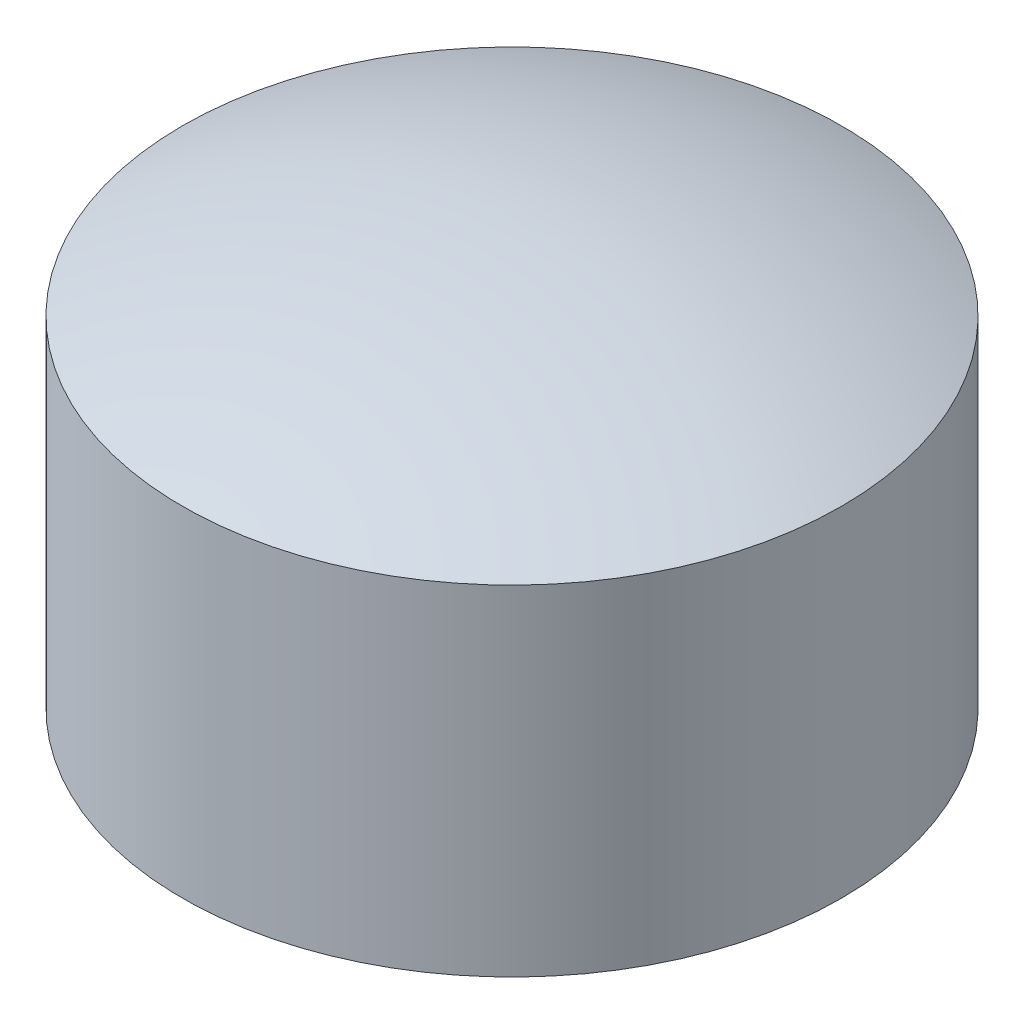
from build123d import *


with BuildPart() as part:
    # Sketch2 → Revolve2 (revolve)
    with BuildSketch(Plane.XY, mode=Mode.PRIVATE) as revolve2_sk:
        with BuildLine():
            Line((83.5, -54.895315199), (83.5, 31.104684801))
            ThreePointArc((83.5, 31.104684801), (42.70904471, 44.553586648), (0, 49.104684801))
            Line((0, 49.104684801), (0, 49.079725779))
            Line((0, 49.079725779), (0, 45.579725779))
            add(Edge.make_bspline(
                [(0, 45.579725779), (40, 45.579725779), (80, 29.109308571)],
                knots=[0.5, 0.5, 0.5, 1, 1, 1], degree=2))
            Line((80, 29.109308571), (80, -54.895315199))
            Line((80, -54.895315199), (83.5, -54.895315199))
        make_face()
    revolve(revolve2_sk.sketch.rotate(Axis((0, 67.604553962, 0), (0, -1, 0)), 180), axis=Axis((0, 67.604553962, 0), (0, -1, 0)))


solid = part.part
